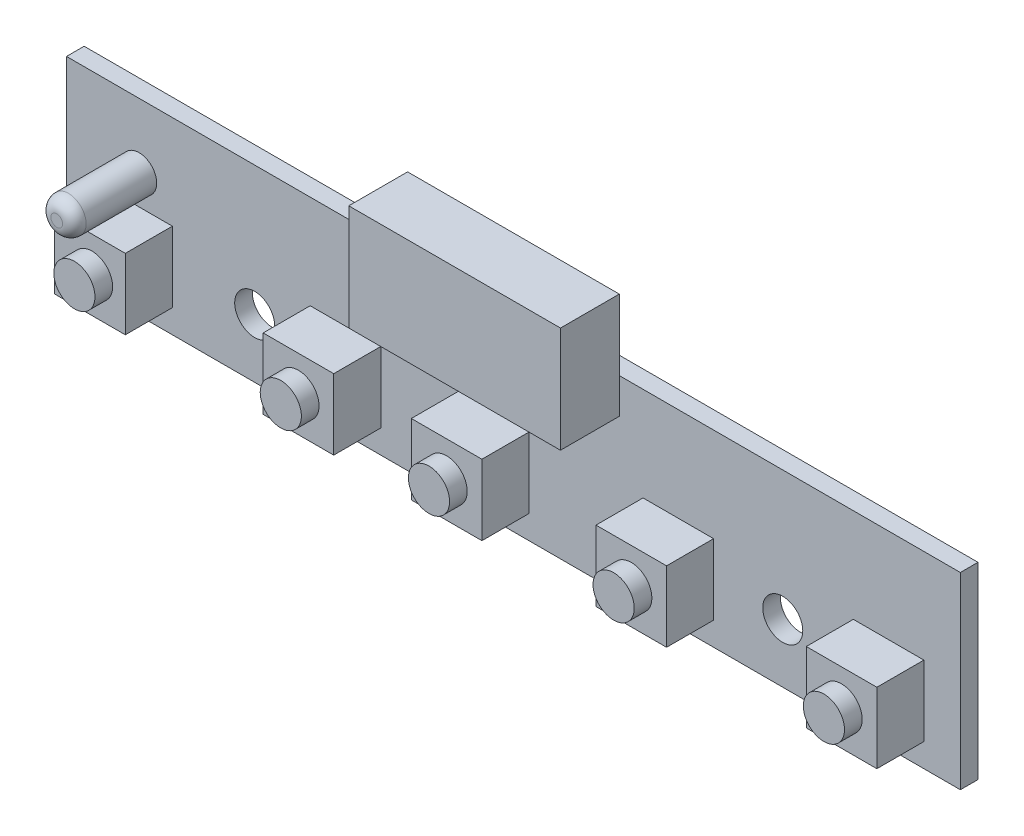
from build123d import *

# Parameters (mm, degrees)
SKETCH1_W            = 76
SKETCH1_H            = 16
BOSS_EXTRUDE1_DEPTH  = 1.5
SKETCH2_W            = 6
SKETCH2_H            = 6
BOSS_EXTRUDE2_DEPTH  = 4
SKETCH3_R            = 1.75
BOSS_EXTRUDE3_DEPTH  = 1.5
SKETCH7_W            = 6
SKETCH7_H            = 6
BOSS_EXTRUDE4_DEPTH  = 4
SKETCH9_R            = 1.75
BOSS_EXTRUDE5_DEPTH  = 1.5
SKETCH11_W           = 6
SKETCH11_H           = 6
BOSS_EXTRUDE6_DEPTH  = 4
SKETCH13_R           = 1.75
BOSS_EXTRUDE7_DEPTH  = 1.5
SKETCH15_W           = 6
SKETCH15_H           = 6
BOSS_EXTRUDE8_DEPTH  = 4
SKETCH17_R           = 1.75
BOSS_EXTRUDE9_DEPTH  = 1.5
SKETCH19_W           = 6
SKETCH19_H           = 6
BOSS_EXTRUDE10_DEPTH = 4
SKETCH21_R           = 1.75
BOSS_EXTRUDE11_DEPTH = 1.5
SKETCH23_R           = 1.5
BOSS_EXTRUDE12_DEPTH = 7
FILLET1_R            = 1
SKETCH24_W           = 18
SKETCH24_H           = 9
BOSS_EXTRUDE13_DEPTH = 5
M3_CLEARANCE_HOLE2_D = 3.4


with BuildPart() as part:
    # Sketch1 → Boss-Extrude1 (new body)
    with BuildSketch(Plane.XY):
        with Locations((38, 8)):
            Rectangle(SKETCH1_W, SKETCH1_H)
    extrude(amount=BOSS_EXTRUDE1_DEPTH)

    # Sketch2 → Boss-Extrude2 (add)
    with BuildSketch(Plane.XY.offset(1.5)):
        with Locations((6, 5)):
            Rectangle(SKETCH2_W, SKETCH2_H)
    extrude(amount=BOSS_EXTRUDE2_DEPTH)

    # Sketch3 → Boss-Extrude3 (add)
    with BuildSketch(Plane.XY.offset(5.5)):
        with Locations(Location((6.17, 5, 0), (0, 0, 180))):
            Circle(SKETCH3_R)
    extrude(amount=BOSS_EXTRUDE3_DEPTH)

    # Sketch7 → Boss-Extrude4 (add)
    with BuildSketch(Plane(origin=(16.242371321, -0.520498802, 1.5), x_dir=(1, 0, 0), z_dir=(0, 0, 1))):
        with Locations((7.477628679, 5.520498802)):
            Rectangle(SKETCH7_W, SKETCH7_H)
    extrude(amount=BOSS_EXTRUDE4_DEPTH)

    # Sketch9 → Boss-Extrude5 (add)
    with BuildSketch(Plane(origin=(16.242371321, -0.520498802, 5.5), x_dir=(1, 0, 0), z_dir=(0, 0, 1))):
        with Locations(Location((7.477628679, 5.520498802, 0), (0, 0, 180))):
            Circle(SKETCH9_R)
    extrude(amount=BOSS_EXTRUDE5_DEPTH)

    # Sketch11 → Boss-Extrude6 (add)
    with BuildSketch(Plane(origin=(28.595266875, 2.580968484, 1.5), x_dir=(1, 0, 0), z_dir=(0, 0, 1))):
        with Locations((7.724733125, 2.419031516)):
            Rectangle(SKETCH11_W, SKETCH11_H)
    extrude(amount=BOSS_EXTRUDE6_DEPTH)

    # Sketch13 → Boss-Extrude7 (add)
    with BuildSketch(Plane(origin=(28.595266875, 2.580968484, 5.5), x_dir=(1, 0, 0), z_dir=(0, 0, 1))):
        with Locations(Location((7.724733125, 2.419031516, 0), (0, 0, 180))):
            Circle(SKETCH13_R)
    extrude(amount=BOSS_EXTRUDE7_DEPTH)

    # Sketch15 → Boss-Extrude8 (add)
    with BuildSketch(Plane(origin=(42.206058337, 2.089594669, 1.5), x_dir=(1, 0, 0), z_dir=(0, 0, 1))):
        with Locations((9.813941663, 2.910405331)):
            Rectangle(SKETCH15_W, SKETCH15_H)
    extrude(amount=BOSS_EXTRUDE8_DEPTH)

    # Sketch17 → Boss-Extrude9 (add)
    with BuildSketch(Plane(origin=(42.206058337, 2.089594669, 5.5), x_dir=(1, 0, 0), z_dir=(0, 0, 1))):
        with Locations(Location((9.813941663, 2.910405331, 0), (0, 0, 180))):
            Circle(SKETCH17_R)
    extrude(amount=BOSS_EXTRUDE9_DEPTH)

    # Sketch19 → Boss-Extrude10 (add)
    with BuildSketch(Plane(origin=(52.604179533, 1.086479777, 1.5), x_dir=(1, 0, 0), z_dir=(0, 0, 1))):
        with Locations((17.295820467, 3.913520223)):
            Rectangle(SKETCH19_W, SKETCH19_H)
    extrude(amount=BOSS_EXTRUDE10_DEPTH)

    # Sketch21 → Boss-Extrude11 (add)
    with BuildSketch(Plane(origin=(52.604179533, 1.086479777, 5.5), x_dir=(1, 0, 0), z_dir=(0, 0, 1))):
        with Locations(Location((17.295820467, 3.913520223, 0), (0, 0, 180))):
            Circle(SKETCH21_R)
    extrude(amount=BOSS_EXTRUDE11_DEPTH)

    # Sketch23 → Boss-Extrude12 (add)
    with BuildSketch(Plane.XY.offset(1.5)):
        with Locations(Location((6.17, 10.5, 0), (0, 0, 180))):
            Circle(SKETCH23_R)
    extrude(amount=BOSS_EXTRUDE12_DEPTH)

    # Fillet1
    fillet1_edges = [part.edges().sort_by_distance(p)[0] for p in [
        (7.67, 10.5, 8.5),
    ]]
    fillet(fillet1_edges, radius=FILLET1_R)

    # Sketch24 → Boss-Extrude13 (add)
    with BuildSketch(Plane.XY.offset(1.5)):
        with Locations((38, 17.5)):
            Rectangle(SKETCH24_W, SKETCH24_H)
    extrude(amount=BOSS_EXTRUDE13_DEPTH)

    # M3 Clearance Hole2 (through all)
    with Locations(Plane.XY.offset(1.5)):
        with Locations((16, 5), (60.9, 5)):
            Hole(M3_CLEARANCE_HOLE2_D / 2)


solid = part.part
